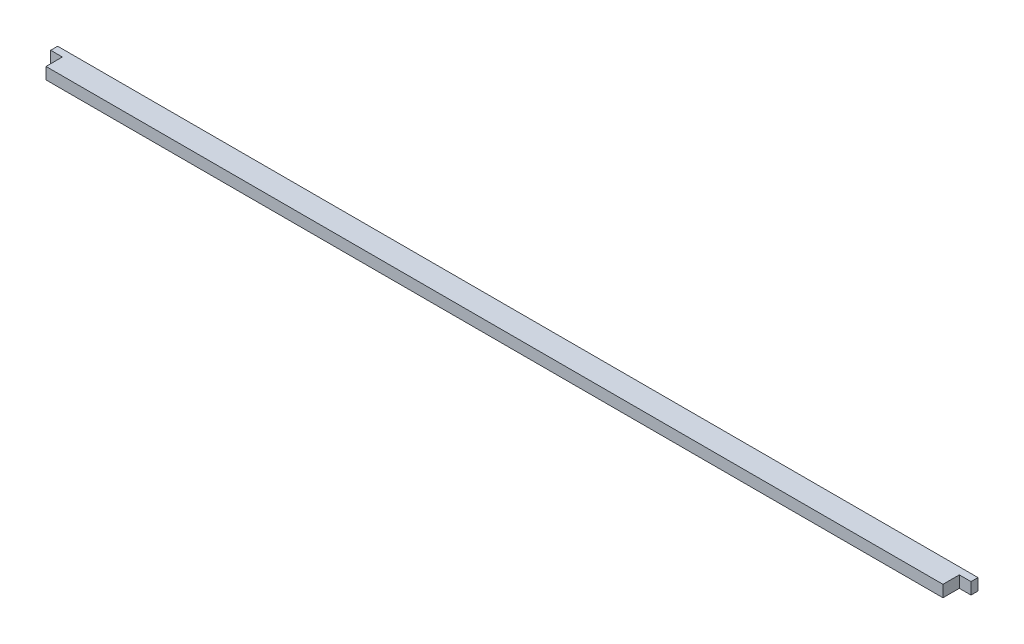
from build123d import *

# Parameters (mm, degrees)
SZKIC1_W                    = 394
SZKIC1_H                    = 10
DODANIE_WYCI_GNI_CIE1_DEPTH = 5
SZKIC2_W                    = 5
SZKIC2_H                    = 7
WYTNIJ_WYCI_GNI_CIE1_DEPTH  = 5


with BuildPart() as part:
    # Szkic1 → Dodanie-wyciągnięcie1 (new body)
    with BuildSketch(Plane(origin=(0, 0, 0), x_dir=(1, 0, 0), z_dir=(0, 1, 0))):
        with Locations((-21.948369565, -77.707880435)):
            Rectangle(SZKIC1_W, SZKIC1_H)
    extrude(amount=DODANIE_WYCI_GNI_CIE1_DEPTH)

    # Szkic2 → Wytnij-wyciągnięcie1 (cut)
    with BuildSketch(Plane(origin=(0, 5, 0), x_dir=(1, 0, 0), z_dir=(0, 1, 0))):
        with Locations((-216.448369565, -79.207880435)):
            Rectangle(SZKIC2_W, SZKIC2_H)
        with Locations((172.551630435, -79.207880435)):
            Rectangle(SZKIC2_W, SZKIC2_H)
    extrude(amount=-WYTNIJ_WYCI_GNI_CIE1_DEPTH, mode=Mode.SUBTRACT)


solid = part.part
